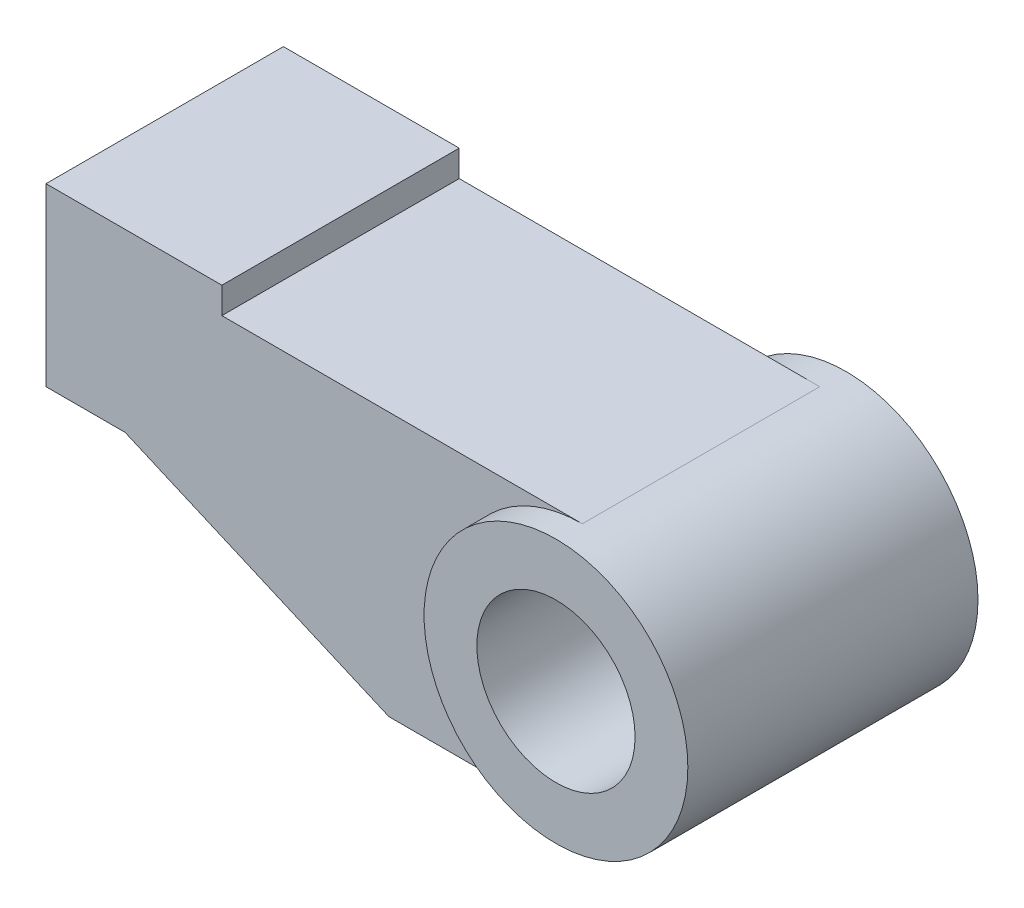
from build123d import *

# Parameters (mm, degrees)
BOSS_EXTRUDE1_DEPTH     = 27
SKETCH2_3_R             = 30
BOSS_EXTRUDE2_DEPTH     = 33
CUT_EXTRUDE1_DEPTH      = 66
CUT_EXTRUDE1_DEPTH_BACK = 66
SKETCH2_4_R             = 18


with BuildPart() as part:
    # Sketch2 → Boss-Extrude1 (new, symmetric)
    with BuildSketch(Plane.XY):
        with BuildLine():
            Line((-44, -30), (0, -30))
            ThreePointArc((0, -30), (30, 0), (0, 30))
            Line((0, 30), (-82, 30))
            Line((-82, 30), (-82, 36))
            Line((-82, 36), (-122, 36))
            Line((-122, 36), (-122, -4))
            Line((-122, -4), (-104, -4))
            Line((-104, -4), (-44, -30))
        make_face()
    extrude(amount=BOSS_EXTRUDE1_DEPTH, both=True)

    # Sketch2<3> → Boss-Extrude2 (add, symmetric)
    with BuildSketch(Plane.XY):
        Circle(SKETCH2_3_R)
    extrude(amount=BOSS_EXTRUDE2_DEPTH, both=True)

    # Sketch2<4> → Cut-Extrude1 (cut, two sides: drawn at the far end of the back side and taken through both)
    with BuildSketch(Plane.XY.offset(-CUT_EXTRUDE1_DEPTH_BACK)):
        Circle(SKETCH2_4_R)
    extrude(amount=CUT_EXTRUDE1_DEPTH + CUT_EXTRUDE1_DEPTH_BACK, mode=Mode.SUBTRACT)


solid = part.part
